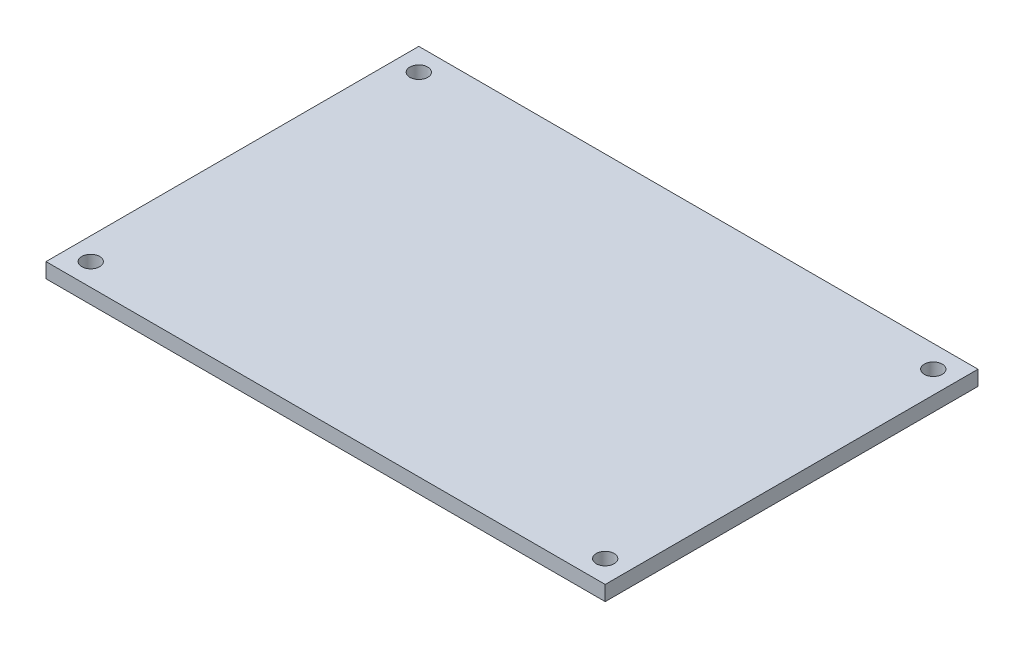
from build123d import *

# Parameters (mm, degrees)
SKETCH1_W           = 375
SKETCH1_H           = 250
SKETCH1_R           = 6
BOSS_EXTRUDE1_DEPTH = 10


with BuildPart() as part:
    # Sketch1 → Boss-Extrude1 (new body)
    with BuildSketch(Plane(origin=(0, 0, 0), x_dir=(1, 0, 0), z_dir=(0, 1, 0))):
        with Locations((187.5, -125)):
            Rectangle(SKETCH1_W, SKETCH1_H)
        with Locations(Location((360, -15, 0), (0, 0, 270))):
            Circle(SKETCH1_R, mode=Mode.SUBTRACT)
        with Locations(Location((15, -15, 0), (0, 0, 90))):
            Circle(SKETCH1_R, mode=Mode.SUBTRACT)
        with Locations(Location((360, -235, 0), (0, 0, 90))):
            Circle(SKETCH1_R, mode=Mode.SUBTRACT)
        with Locations(Location((15, -235, 0), (0, 0, 270))):
            Circle(SKETCH1_R, mode=Mode.SUBTRACT)
    extrude(amount=BOSS_EXTRUDE1_DEPTH)


solid = part.part
